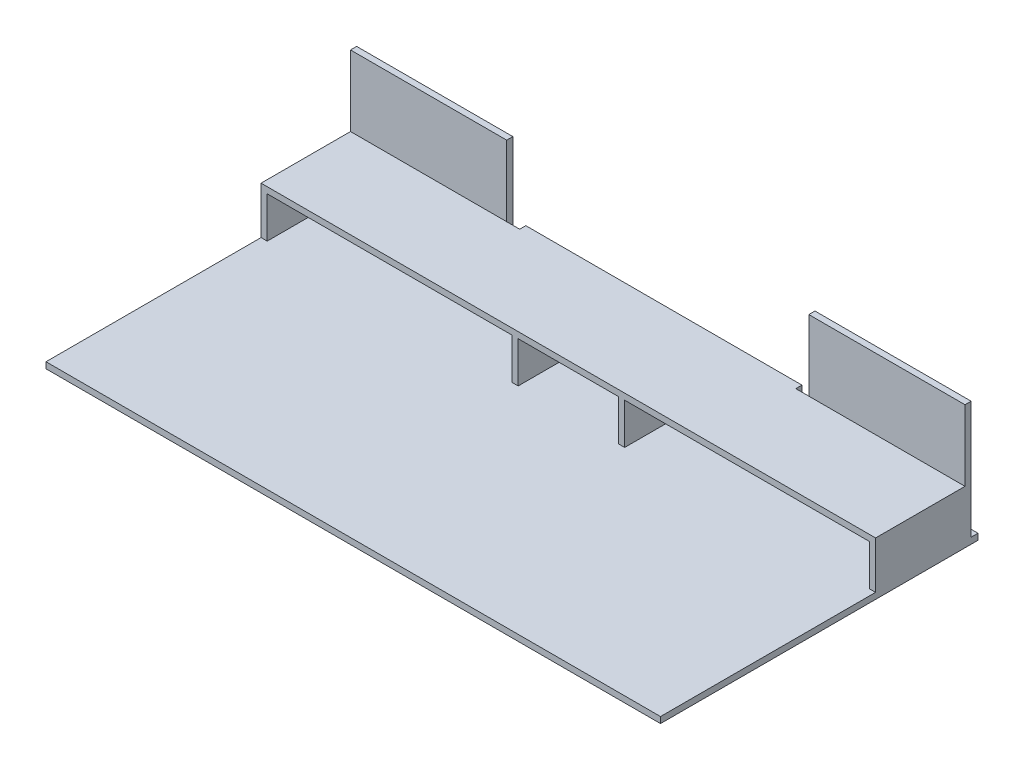
from build123d import *

# Parameters (mm, degrees)
SKETCH1_W           = 1200
SKETCH1_H           = 620
BOSS_EXTRUDE1_DEPTH = 12
SKETCH2_W           = 12
SKETCH2_H           = 174.6
BOSS_EXTRUDE2_DEPTH = 80
SKETCH6_W           = 1200
SKETCH6_H           = 174.6
BOSS_EXTRUDE5_DEPTH = 12
SKETCH7_W           = 305
SKETCH7_H           = 12
BOSS_EXTRUDE6_DEPTH = 230
SKETCH8_W           = 539.2
SKETCH8_H           = 35
BOSS_EXTRUDE7_DEPTH = 12


with BuildPart() as part:
    # Sketch1 → Boss-Extrude1 (new body)
    with BuildSketch(Plane(origin=(0, 0, 0), x_dir=(1, 0, 0), z_dir=(0, 1, 0))):
        Rectangle(SKETCH1_W, SKETCH1_H)
    extrude(amount=BOSS_EXTRUDE1_DEPTH)

    # Sketch2 → Boss-Extrude2 (add)
    with BuildSketch(Plane(origin=(0, 12, 0), x_dir=(1, 0, 0), z_dir=(0, 1, 0))):
        with Locations((-594, 197.3)):
            Rectangle(SKETCH2_W, SKETCH2_H)
        with Locations((-104, 197.3)):
            Rectangle(SKETCH2_W, SKETCH2_H)
        with Locations((104, 197.3)):
            Rectangle(SKETCH2_W, SKETCH2_H)
        with Locations((594, 197.3)):
            Rectangle(SKETCH2_W, SKETCH2_H)
    extrude(amount=BOSS_EXTRUDE2_DEPTH)

    # Sketch6 → Boss-Extrude5 (add)
    with BuildSketch(Plane(origin=(0, 92, 0), x_dir=(1, 0, 0), z_dir=(0, 1, 0))):
        with Locations((0, 197.3)):
            Rectangle(SKETCH6_W, SKETCH6_H)
    extrude(amount=BOSS_EXTRUDE5_DEPTH)

    # Sketch7 → Boss-Extrude6 (add)
    with BuildSketch(Plane(origin=(0, 12, 0), x_dir=(1, 0, 0), z_dir=(0, 1, 0))):
        with Locations((-447.5, 290.6)):
            Rectangle(SKETCH7_W, SKETCH7_H)
        with Locations((447.5, 290.6)):
            Rectangle(SKETCH7_W, SKETCH7_H)
    extrude(amount=BOSS_EXTRUDE6_DEPTH)

    # Sketch8 → Boss-Extrude7 (add)
    with BuildSketch(Plane(origin=(0, 0, -284.6), x_dir=(-1, 0, 0), z_dir=(0, 0, -1))):
        with Locations((0, 86.5)):
            Rectangle(SKETCH8_W, SKETCH8_H)
    extrude(amount=BOSS_EXTRUDE7_DEPTH)


solid = part.part
